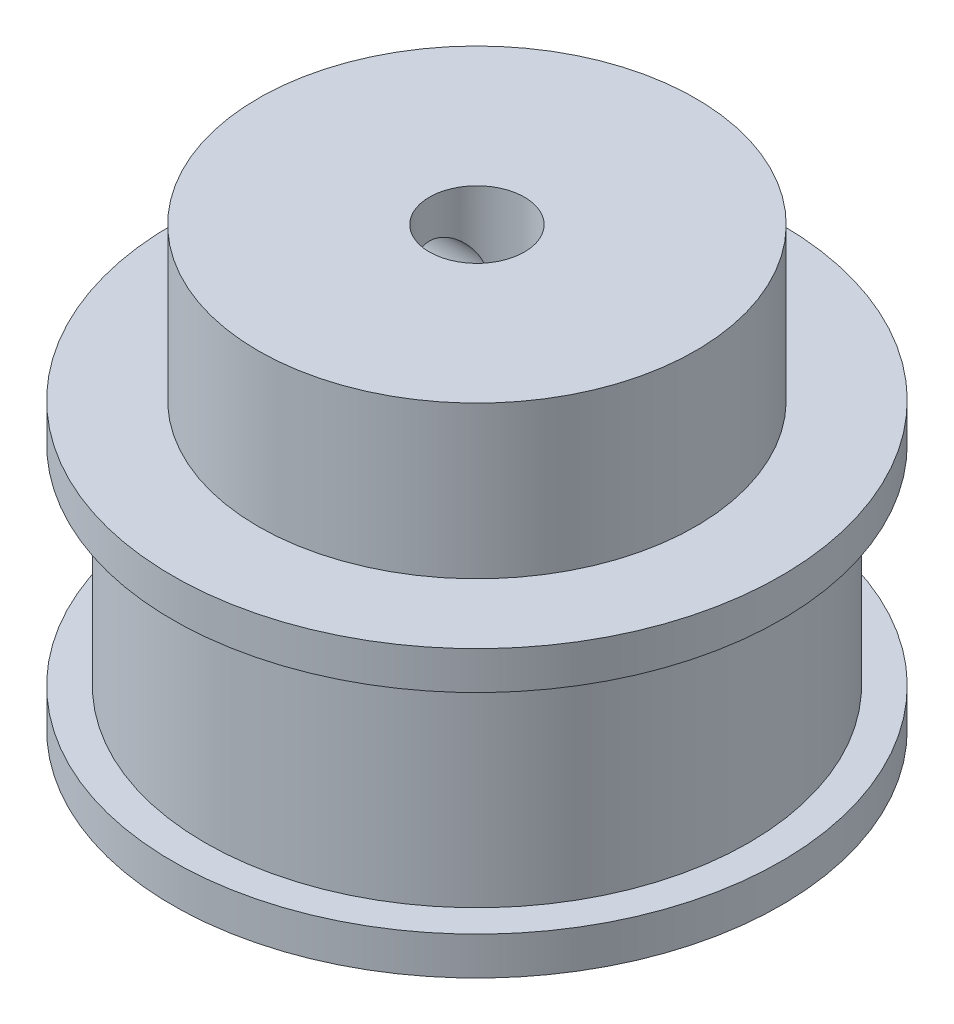
from build123d import *

# Parameters (mm, degrees)
SKETCH_1_R          = 11.5
SKETCH_1_R_2        = 2.5
EXTRUDE_1_DEPTH     = 8
SKETCH_2_R          = 16
EXTRUDE_2_DEPTH     = 2
SKETCH_3_R          = 14.3
EXTRUDE_3_DEPTH     = 11
SKETCH_4_R          = 16
EXTRUDE_4_DEPTH     = 2
SKETCH_5_R          = 2
CUT_EXTRUDE_1_DEPTH = 19


with BuildPart() as part:
    # 草图1 → 凸台-拉伸1 (new body)
    with BuildSketch(Plane(origin=(0, 0, 0), x_dir=(1, 0, 0), z_dir=(0, 1, 0))):
        with Locations(Location((0, 0, 0), (0, 0, 270))):
            Circle(SKETCH_1_R)
        with Locations(Location((0, 0, 0), (0, 0, 270))):
            Circle(SKETCH_1_R_2, mode=Mode.SUBTRACT)
    extrude(amount=EXTRUDE_1_DEPTH)

    # 草图2 → 凸台-拉伸2 (add)
    with BuildSketch(Plane.XZ):
        with Locations(Location((0, 0, 0), (0, 0, 270))):
            Circle(SKETCH_2_R)
    extrude(amount=EXTRUDE_2_DEPTH)

    # 草图3 → 凸台-拉伸3 (add)
    with BuildSketch(Plane.XZ.offset(2)):
        with Locations(Location((0, 0, 0), (0, 0, 270))):
            Circle(SKETCH_3_R)
    extrude(amount=EXTRUDE_3_DEPTH)

    # 草图4 → 凸台-拉伸4 (add)
    with BuildSketch(Plane.XZ.offset(13)):
        with Locations(Location((0, 0, 0), (0, 0, 270))):
            Circle(SKETCH_4_R)
    extrude(amount=EXTRUDE_4_DEPTH)

    # 草图5 → 切除-拉伸1 (cut)
    with BuildSketch(Plane(origin=(0, 0, 0), x_dir=(0, 0, -1), z_dir=(1, 0, 0))):
        with Locations((0, 4)):
            Circle(SKETCH_5_R)
    extrude(amount=-CUT_EXTRUDE_1_DEPTH, mode=Mode.SUBTRACT)


solid = part.part
